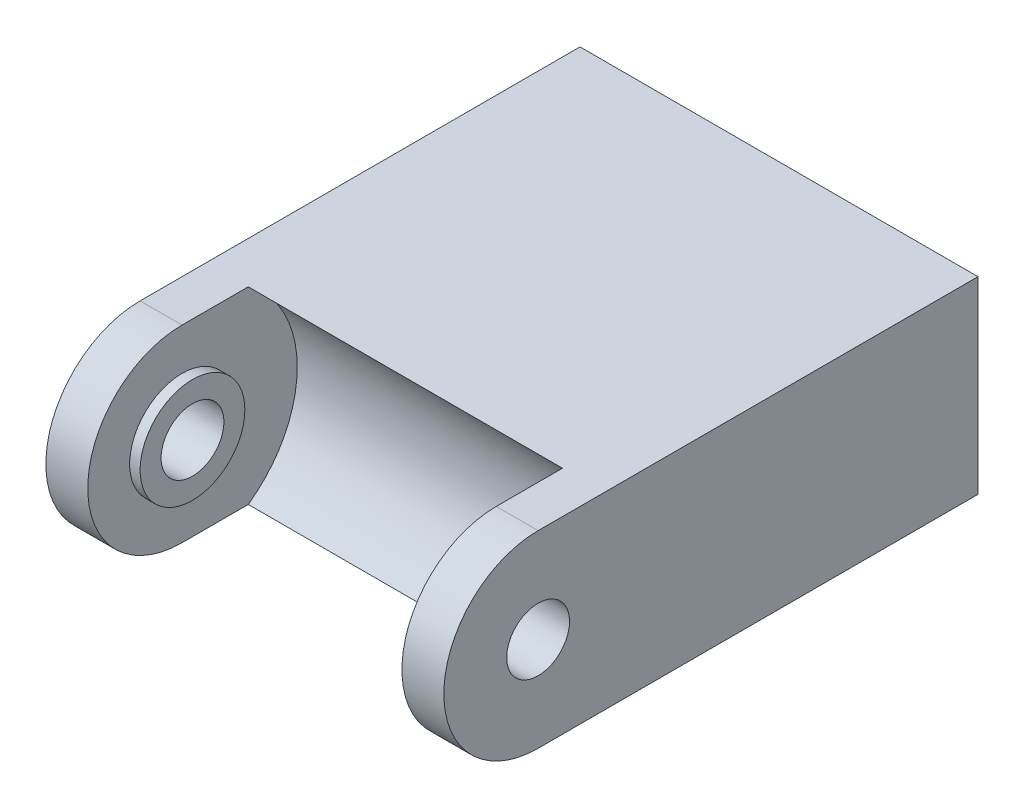
from build123d import *
from build123d.topology import SkipClean

# Parameters (mm, degrees)
EXTRUDE_1_DEPTH          = 9.5
EXTRUDE_1_DEPTH_BACK     = 9.5
CUT_EXTRUDE_1_DEPTH      = 7
CUT_EXTRUDE_1_DEPTH_BACK = 7
SKETCH_2_R               = 5.5
CUT_EXTRUDE_2_DEPTH      = 24.484037132
CUT_EXTRUDE_2_DEPTH_BACK = 24.484037132
SKETCH_3_R               = 1.5
CUT_EXTRUDE_3_DEPTH      = 7.5
CUT_EXTRUDE_3_DEPTH_BACK = 7.5
SKETCH_4_R               = 5.5
SKETCH_4_R_2             = 2.5
SKETCH_5_R               = 1.75
CUT_EXTRUDE_4_DEPTH      = 2


with BuildPart() as part:
    # Эскиз1 → Бобышка-Вытянуть1 (new, two sides: drawn at the far end of the back side and taken through both)
    with BuildSketch(Plane(origin=(0, 0, 0), x_dir=(0, 0, -1), z_dir=(1, 0, 0)).offset(-EXTRUDE_1_DEPTH_BACK)):
        with BuildLine():
            Line((21, 4.5), (0, 4.5))
            ThreePointArc((0, 4.5), (-4.5, 0), (0, -4.5))
            Line((0, -4.5), (21, -4.5))
            Line((21, -4.5), (21, 4.5))
        make_face()
    extrude(amount=EXTRUDE_1_DEPTH + EXTRUDE_1_DEPTH_BACK)

    # Эскиз2 → Вырез-Вытянуть1 (cut, two sides: drawn at the far end of the back side and taken through both)
    with BuildSketch(Plane(origin=(0, 0, 0), x_dir=(0, 0, -1), z_dir=(1, 0, 0)).offset(-CUT_EXTRUDE_1_DEPTH_BACK)):
        Circle(SKETCH_2_R)
    extrude(amount=CUT_EXTRUDE_1_DEPTH + CUT_EXTRUDE_1_DEPTH_BACK, mode=Mode.SUBTRACT)

    # Эскиз3 → Вырез-Вытянуть2 (cut, two sides: drawn at the far end of the back side and taken through both)
    with BuildSketch(Plane(origin=(0, 0, 0), x_dir=(0, 0, -1), z_dir=(1, 0, 0)).offset(-CUT_EXTRUDE_2_DEPTH_BACK)):
        Circle(SKETCH_3_R)
    extrude(amount=CUT_EXTRUDE_2_DEPTH + CUT_EXTRUDE_2_DEPTH_BACK, mode=Mode.SUBTRACT)

    # Эскиз4 → Вырез-Вытянуть3 (cut, two sides: drawn at the far end of the back side and taken through both)
    with SkipClean():  # the faces are left unmerged after this step: merging them gives an invalid solid
        with BuildSketch(Plane(origin=(0, 0, 0), x_dir=(0, 0, -1), z_dir=(1, 0, 0)).offset(-CUT_EXTRUDE_3_DEPTH_BACK)):
            Circle(SKETCH_4_R)
            Circle(SKETCH_4_R_2, mode=Mode.SUBTRACT)
        extrude(amount=CUT_EXTRUDE_3_DEPTH + CUT_EXTRUDE_3_DEPTH_BACK, mode=Mode.SUBTRACT)
    add(part.part.scale(1), mode=Mode.REPLACE)  # the faces are merged on a copy

    # Эскиз5 → Вырез-Вытянуть4 (cut)
    with BuildSketch(Plane(origin=(0, 0, -21), x_dir=(-1, 0, 0), z_dir=(0, 0, -1))):
        Circle(SKETCH_5_R)
    extrude(amount=-CUT_EXTRUDE_4_DEPTH, mode=Mode.SUBTRACT)


solid = part.part
